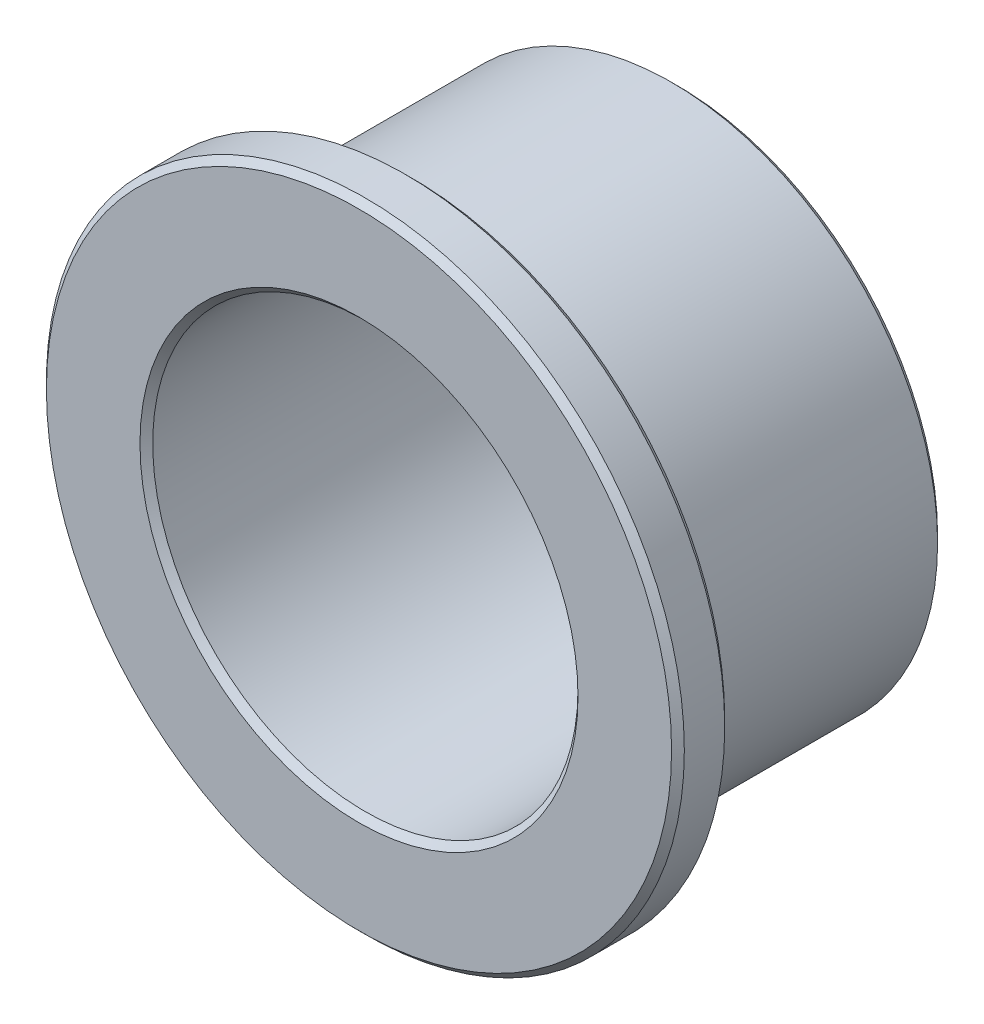
from build123d import *

# Parameters (mm, degrees)
BOSS_EXTRUDE1_START = 9.525
SKETCH3_R           = 19.05
SKETCH3_R_2         = 12.7
BOSS_EXTRUDE1_DEPTH = 3.175
BOSS_EXTRUDE2_START = 6.35
SKETCH4_R           = 15.8877
SKETCH4_R_2         = 12.7
BOSS_EXTRUDE2_DEPTH = 15.875
CHAMFER1_SIZE       = 0.381


with BuildPart() as part:
    # Sketch3 → Boss-Extrude1 (new body)
    with BuildSketch(Plane.XY.offset(BOSS_EXTRUDE1_START)):
        Circle(SKETCH3_R)
        Circle(SKETCH3_R_2, mode=Mode.SUBTRACT)
    extrude(amount=-BOSS_EXTRUDE1_DEPTH)

    # Sketch4 → Boss-Extrude2 (add)
    with BuildSketch(Plane.XY.offset(BOSS_EXTRUDE2_START)):
        Circle(SKETCH4_R)
        Circle(SKETCH4_R_2, mode=Mode.SUBTRACT)
    extrude(amount=-BOSS_EXTRUDE2_DEPTH)

    # Chamfer1
    chamfer1_edges = [part.edges().sort_by_distance(p)[0] for p in [
        (-12.7, 0, -9.525),
        (-15.8877, 0, 6.35),
        (-19.05, 0, 9.525),
        (-19.05, 0, 6.35),
        (-12.7, 0, 9.525),
        (-15.8877, 0, -9.525),
    ]]
    chamfer(chamfer1_edges, length=CHAMFER1_SIZE)


solid = part.part
